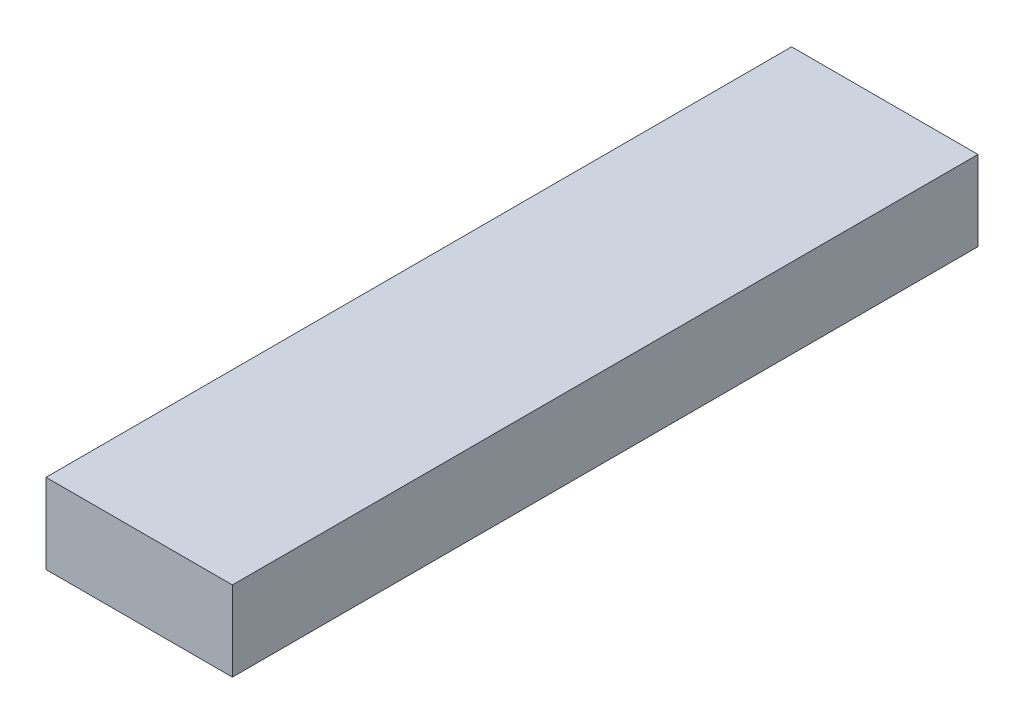
from build123d import *

# Parameters (mm, degrees)
SKETCH1_W           = 88.9
SKETCH1_H           = 38.1
BOSS_EXTRUDE1_DEPTH = 355.6


with BuildPart() as part:
    # Sketch1 → Boss-Extrude1 (new body)
    with BuildSketch(Plane.XY):
        with Locations((44.45, 19.05)):
            Rectangle(SKETCH1_W, SKETCH1_H)
    extrude(amount=BOSS_EXTRUDE1_DEPTH)


solid = part.part
